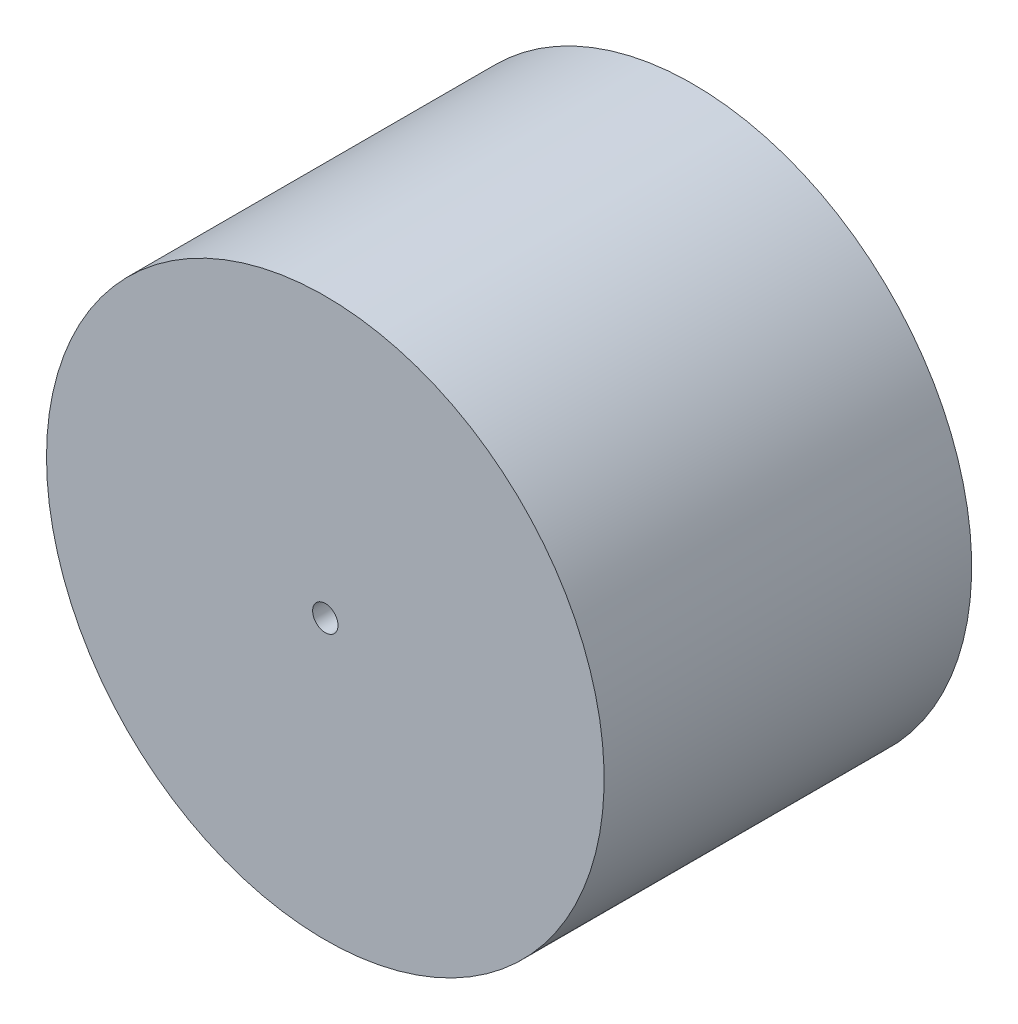
from build123d import *

# Parameters (mm, degrees)
SKETCH1_R           = 22
SKETCH1_R_2         = 1
BOSS_EXTRUDE1_DEPTH = 29


with BuildPart() as part:
    # Sketch1 → Boss-Extrude1 (new body)
    with BuildSketch(Plane.XY):
        with Locations(Location((0, 0, 0), (0, 0, 180))):
            Circle(SKETCH1_R)
        with Locations(Location((0, 0, 0), (0, 0, 180))):
            Circle(SKETCH1_R_2, mode=Mode.SUBTRACT)
    extrude(amount=BOSS_EXTRUDE1_DEPTH)


solid = part.part
